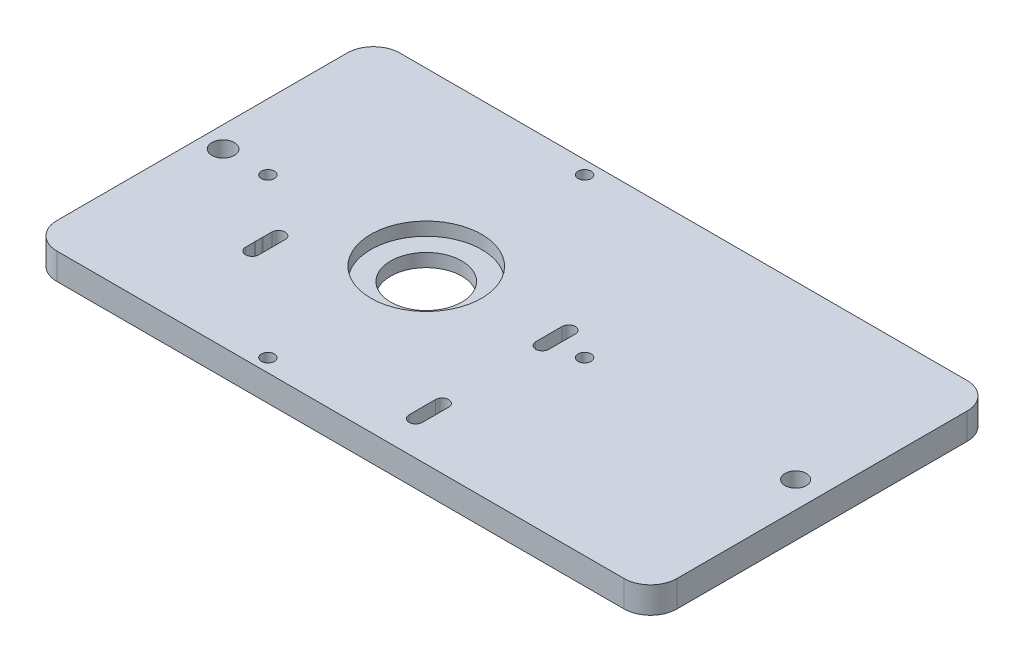
from build123d import *

# Parameters (mm, degrees)
SKETCH1_R           = 2.475
SKETCH1_R_2         = 4.025
SKETCH1_R_3         = 21
BOSS_EXTRUDE1_DEPTH = 10
SKETCH1_5_R         = 4.25
BOSS_EXTRUDE4_DEPTH = 10
SKETCH1_4_R         = 21
SKETCH1_4_R_2       = 13.5
BOSS_EXTRUDE2_DEPTH = 5
FILLET1_R           = 10


with BuildPart() as part:
    # Sketch1 → Boss-Extrude1 (new body)
    with BuildSketch(Plane(origin=(0, 0, 0), x_dir=(1, 0, 0), z_dir=(0, 1, 0))):
        with BuildLine():
            ThreePointArc((0, 65), (-65, 0), (0, -65))
            Line((0, -65), (150, -65))
            Line((150, -65), (150, 65))
            Line((150, 65), (0, 65))
        make_face()
        with BuildLine():
            ThreePointArc((45.5, -42), (48, -39.5), (50.5, -42))
            Line((50.5, -42), (50.5, -52))
            ThreePointArc((50.5, -52), (48, -54.5), (45.5, -52))
            Line((45.5, -52), (45.5, -42))
        make_face(mode=Mode.SUBTRACT)
        with Locations((0, -60)):
            Circle(SKETCH1_R, mode=Mode.SUBTRACT)
        with Locations((-60, 0)):
            Circle(SKETCH1_R, mode=Mode.SUBTRACT)
        with Locations((0, 60)):
            Circle(SKETCH1_R, mode=Mode.SUBTRACT)
        with Locations((60, 0)):
            Circle(SKETCH1_R, mode=Mode.SUBTRACT)
        with Locations((140, 0)):
            Circle(SKETCH1_R_2, mode=Mode.SUBTRACT)
        with BuildLine():
            Line((50.5, 6), (50.5, -4))
            ThreePointArc((50.5, -4), (48, -6.5), (45.5, -4))
            Line((45.5, -4), (45.5, 6))
            ThreePointArc((45.5, 6), (48, 8.5), (50.5, 6))
        make_face(mode=Mode.SUBTRACT)
        with BuildLine():
            ThreePointArc((-40.5, -24.604436172), (-40.518742246, -24.42765838), (-40.525, -24.25))
            Line((-40.525, -24.25), (-40.525, -21.75))
            ThreePointArc((-40.525, -21.75), (-40.518742246, -21.57234162), (-40.5, -21.395563828))
            Line((-40.5, -21.395563828), (-40.5, -18))
            ThreePointArc((-40.5, -18), (-38, -15.5), (-35.5, -18))
            Line((-35.5, -18), (-35.5, -21.395563828))
            ThreePointArc((-35.5, -21.395563828), (-35.481257754, -21.57234162), (-35.475, -21.75))
            Line((-35.475, -21.75), (-35.475, -24.25))
            ThreePointArc((-35.475, -24.25), (-35.481257754, -24.42765838), (-35.5, -24.604436172))
            Line((-35.5, -24.604436172), (-35.5, -28))
            ThreePointArc((-35.5, -28), (-38, -30.5), (-40.5, -28))
            Line((-40.5, -28), (-40.5, -24.604436172))
        make_face(mode=Mode.SUBTRACT)
        Circle(SKETCH1_R_3, mode=Mode.SUBTRACT)
    extrude(amount=BOSS_EXTRUDE1_DEPTH)

    # Sketch1<5> → Boss-Extrude4 (add)
    with BuildSketch(Plane(origin=(0, 0, 0), x_dir=(1, 0, 0), z_dir=(0, 1, 0))):
        with BuildLine():
            ThreePointArc((0, -65), (-65, 0), (0, 65))
            Line((0, 65), (-85, 65))
            Line((-85, 65), (-85, -65))
            Line((-85, -65), (0, -65))
        make_face()
        with Locations((-77, 0)):
            Circle(SKETCH1_5_R, mode=Mode.SUBTRACT)
    extrude(amount=BOSS_EXTRUDE4_DEPTH)

    # Sketch1<4> → Boss-Extrude2 (add)
    with BuildSketch(Plane(origin=(0, 0, 0), x_dir=(1, 0, 0), z_dir=(0, 1, 0))):
        Circle(SKETCH1_4_R)
        Circle(SKETCH1_4_R_2, mode=Mode.SUBTRACT)
    extrude(amount=BOSS_EXTRUDE2_DEPTH)

    # Fillet1
    fillet1_edges = [part.edges().sort_by_distance(p)[0] for p in [
        (150, 5, 65),
        (150, 5, -65),
        (-85, 5, -65),
        (-85, 5, 65),
    ]]
    fillet(fillet1_edges, radius=FILLET1_R)


solid = part.part
